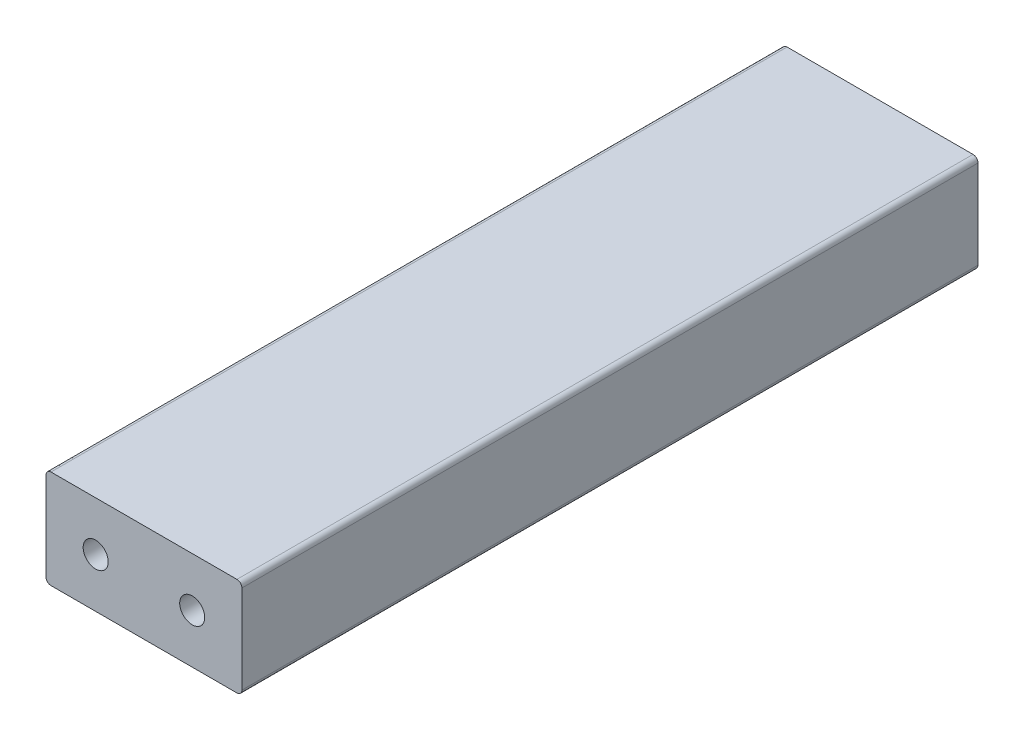
from build123d import *

# Parameters (mm, degrees)
SKETCH1_W                        = 39.9542
SKETCH1_H                        = 20.066
BOSS_EXTRUDE1_DEPTH              = 75.057
FILLET1_R                        = 1.016
F_1_4_20_TAPPED_HOLE1_AT_2_COUNT = 2
F_1_4_20_TAPPED_HOLE1_AT_2_PITCH = 19.685


with BuildPart() as part:
    # Sketch1 → Boss-Extrude1 (new, symmetric)
    with BuildSketch(Plane.XY):
        Rectangle(SKETCH1_W, SKETCH1_H)
    extrude(amount=BOSS_EXTRUDE1_DEPTH, both=True)

    # Fillet1
    fillet1_edges = [part.edges().sort_by_distance(p)[0] for p in [
        (19.9771, -10.033, 0),
        (-19.9771, -10.033, 0),
        (-19.9771, 10.033, 0),
        (19.9771, 10.033, 0),
    ]]
    fillet(fillet1_edges, radius=FILLET1_R)

    # Sketch4 → 1/4-20 Tapped Hole1 (revolve, cut)
    with BuildSketch(Plane(origin=(9.8425, 0, -75.057), x_dir=(0, 1, 0), z_dir=(1, 0, 0))):
        Polygon((0, 0), (0, 18.043816902), (2.5527, 16.51), (2.5527, 0), align=None)
    f_1_4_20_tapped_hole1 = revolve(axis=Axis((9.8425, 0, -81.407), (0, 0, 1)), mode=Mode.SUBTRACT)

    # 1/4-20 Tapped Hole1 at 2: 1/4-20 Tapped Hole1 ×2
    with Locations(*[(-i * F_1_4_20_TAPPED_HOLE1_AT_2_PITCH, 0, 0) for i in range(1, F_1_4_20_TAPPED_HOLE1_AT_2_COUNT)]):
        add(f_1_4_20_tapped_hole1, mode=Mode.SUBTRACT)

    # Mirror1: 1/4-20 Tapped Hole1 across plane
    add(f_1_4_20_tapped_hole1.mirror(Plane.XY), mode=Mode.SUBTRACT)

    # Mirror1 copy 1 sketch → Mirror1 copy 1 (revolve, cut)
    with BuildSketch(Plane(origin=(-9.8425, 0, 75.057), x_dir=(0, 1, 0), z_dir=(1, 0, 0))):
        Polygon((0, 0), (0, -18.043816902), (2.5527, -16.51), (2.5527, 0), align=None)
    revolve(axis=Axis((-9.8425, 0, 81.407), (0, 0, 1)), mode=Mode.SUBTRACT)


solid = part.part
